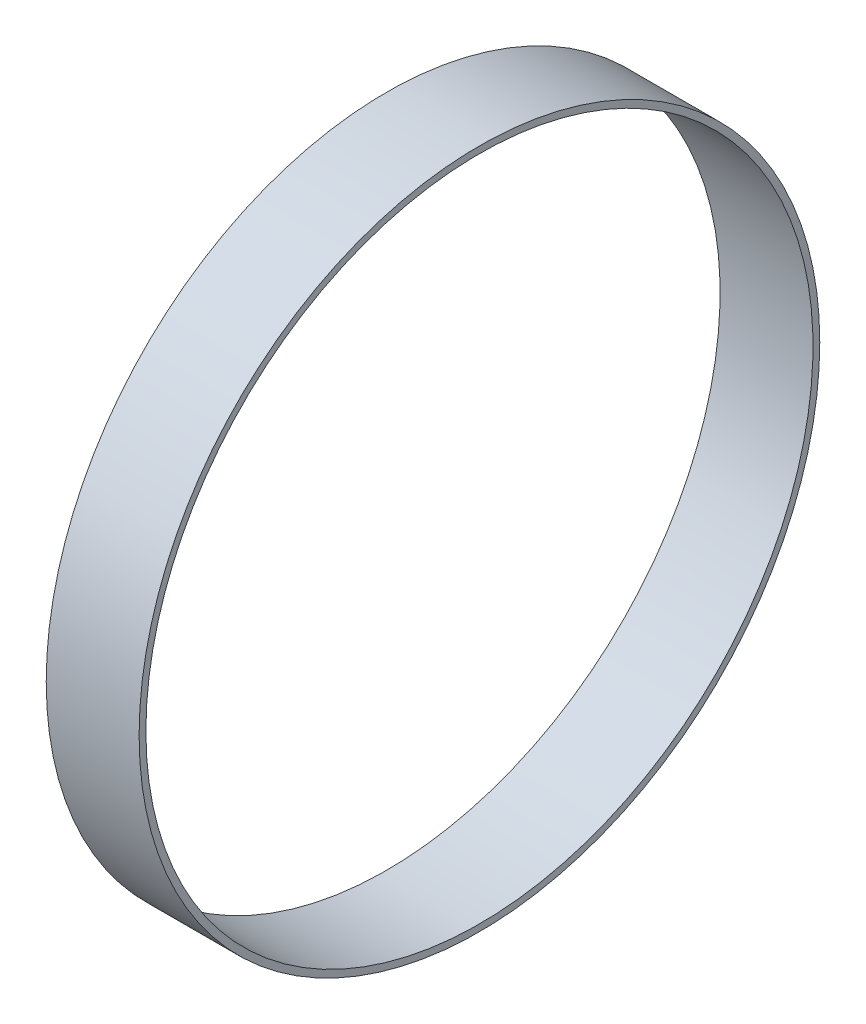
from build123d import *

# Parameters (mm, degrees)
ESQUISSE1_W = 13.7
ESQUISSE1_H = 1


with BuildPart() as part:
    # Esquisse1 → Base-Révol.-Mince (revolve)
    with BuildSketch(Plane.XY, mode=Mode.PRIVATE) as base_r_vol_mince_sk:
        with Locations((84.95, 49.7)):
            Rectangle(ESQUISSE1_W, ESQUISSE1_H)
    revolve(base_r_vol_mince_sk.sketch.rotate(Axis((0, 0, 0), (1, 0, 0)), 90), axis=Axis((0, 0, 0), (1, 0, 0)))


solid = part.part
